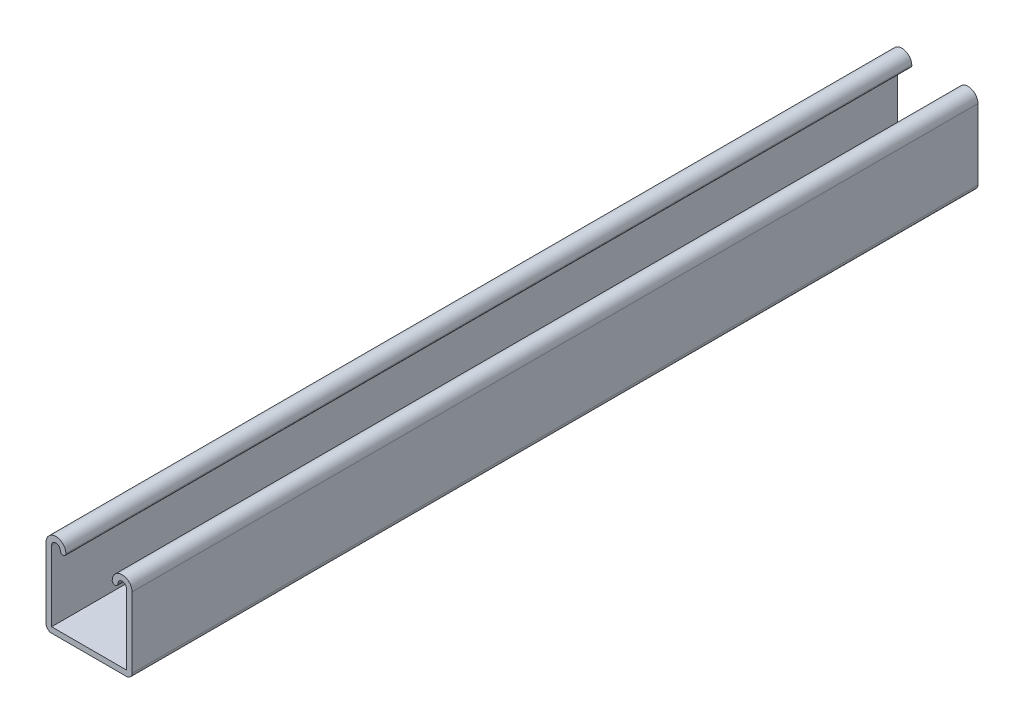
from build123d import *

# Parameters (mm, degrees)
EXTRUDE_1_DEPTH = 406.4


with BuildPart() as part:
    # 草图1 → 凸台-拉伸1 (new body)
    with BuildSketch(Plane.XY):
        with BuildLine():
            Line((0, 0), (35.98, 0))
            ThreePointArc((35.98, 0), (37.883814298, 0.788585702), (38.6724, 2.6924))
            Line((38.6724, 2.6924), (38.6724, 36.5252))
            ThreePointArc((38.6724, 36.5252), (33.8972, 41.3004), (29.122, 36.5252))
            ThreePointArc((29.122, 36.5252), (30.4682, 35.179), (31.8144, 36.5252))
            ThreePointArc((31.8144, 36.5252), (33.8972, 38.608), (35.98, 36.5252))
            Line((35.98, 36.5252), (35.98, 2.6924))
            Line((35.98, 2.6924), (0, 2.6924))
            Line((0, 2.6924), (0, 36.5252))
            ThreePointArc((0, 36.5252), (2.0828, 38.608), (4.1656, 36.5252))
            ThreePointArc((4.1656, 36.5252), (5.5118, 35.179), (6.858, 36.5252))
            ThreePointArc((6.858, 36.5252), (2.0828, 41.3004), (-2.6924, 36.5252))
            Line((-2.6924, 36.5252), (-2.6924, 2.6924))
            ThreePointArc((-2.6924, 2.6924), (-1.903814298, 0.788585702), (0, 0))
        make_face()
    extrude(amount=EXTRUDE_1_DEPTH)


solid = part.part
